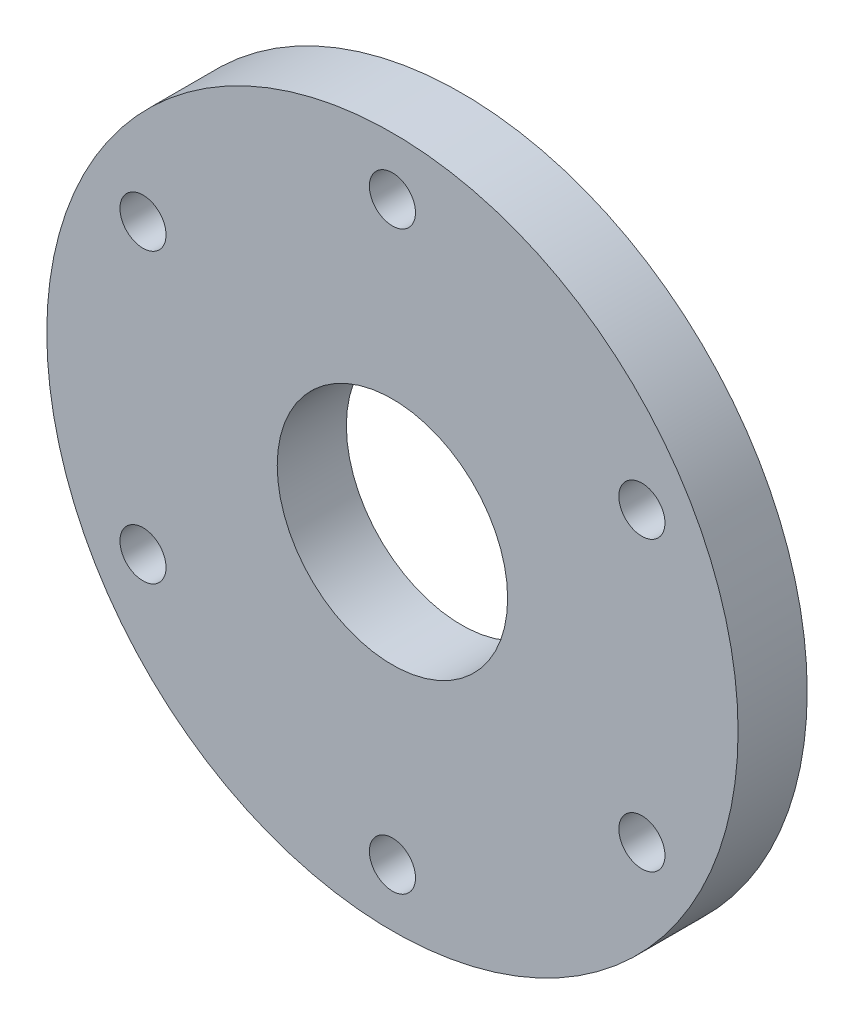
from build123d import *

# Parameters (mm, degrees)
SKETCH1_R           = 30
SKETCH1_R_2         = 10
SKETCH1_R_3         = 2
BOSS_EXTRUDE1_DEPTH = 6


with BuildPart() as part:
    # Sketch1 → Boss-Extrude1 (new body)
    with BuildSketch(Plane.XY):
        Circle(SKETCH1_R)
        Circle(SKETCH1_R_2, mode=Mode.SUBTRACT)
        with Locations((0, 25)):
            Circle(SKETCH1_R_3, mode=Mode.SUBTRACT)
        with Locations((21.650635095, 12.5)):
            Circle(SKETCH1_R_3, mode=Mode.SUBTRACT)
        with Locations((21.650635095, -12.5)):
            Circle(SKETCH1_R_3, mode=Mode.SUBTRACT)
        with Locations((0, -25)):
            Circle(SKETCH1_R_3, mode=Mode.SUBTRACT)
        with Locations((-21.650635095, -12.5)):
            Circle(SKETCH1_R_3, mode=Mode.SUBTRACT)
        with Locations((-21.650635095, 12.5)):
            Circle(SKETCH1_R_3, mode=Mode.SUBTRACT)
    extrude(amount=BOSS_EXTRUDE1_DEPTH)


solid = part.part
